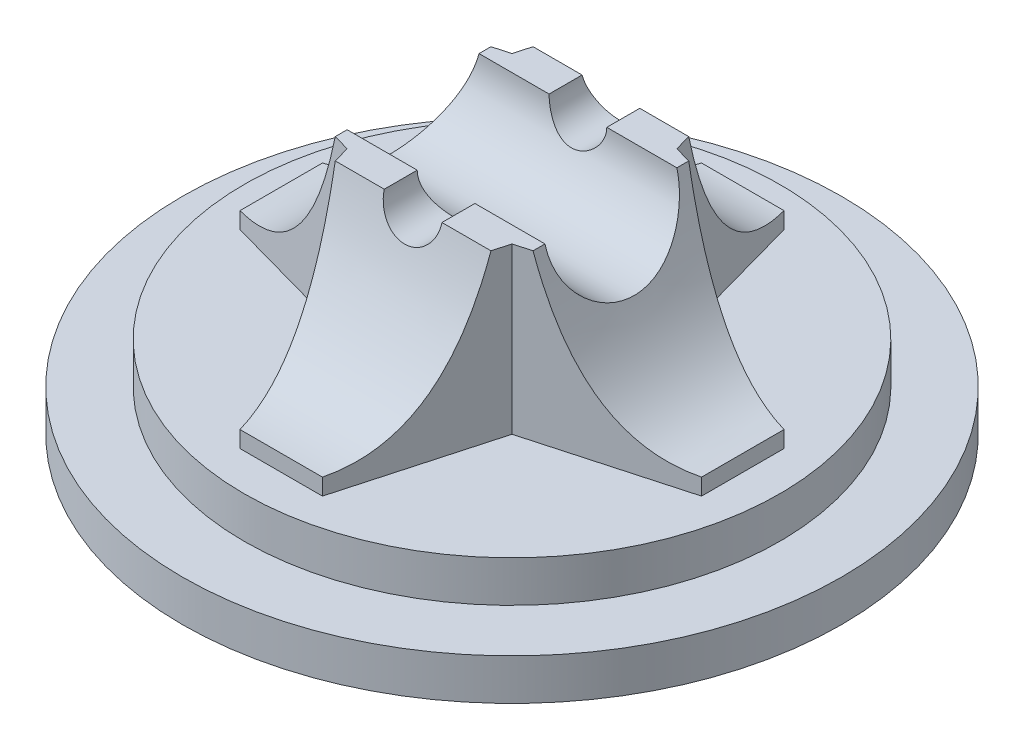
from build123d import *

# Parameters (mm, degrees)
SKETCH1_R           = 40
BOSS_EXTRUDE1_DEPTH = 5
SKETCH2_R           = 32.5
BOSS_EXTRUDE2_DEPTH = 5
BOSS_EXTRUDE3_DEPTH = 20
CUT_EXTRUDE15_DEPTH = 85.403791384
CUT_EXTRUDE16_DEPTH = 85.40379142
CUT_EXTRUDE22_DEPTH = 85.40379142
CUT_EXTRUDE23_DEPTH = 85.40379142


with BuildPart() as part:
    # Sketch1 → Boss-Extrude1 (new body)
    with BuildSketch(Plane(origin=(0, 0, 0), x_dir=(1, 0, 0), z_dir=(0, 1, 0))):
        Circle(SKETCH1_R)
    extrude(amount=BOSS_EXTRUDE1_DEPTH)

    # Sketch2 → Boss-Extrude2 (add)
    with BuildSketch(Plane(origin=(0, 5, 0), x_dir=(1, 0, 0), z_dir=(0, 1, 0))):
        Circle(SKETCH2_R)
    extrude(amount=BOSS_EXTRUDE2_DEPTH)

    # Sketch6 → Boss-Extrude3 (add)
    with BuildSketch(Plane(origin=(0, 10, 0), x_dir=(1, 0, 0), z_dir=(0, 1, 0))):
        Polygon((5, -28), (10, -10), (28, -5), (28, 5), (10, 10), (5, 28), (-5, 28), (-10, 10), (-28, 5), (-28, -5), (-10, -10), (-5, -28), align=None)
    extrude(amount=BOSS_EXTRUDE3_DEPTH)

    # Sketch12 → Cut-Extrude15 (cut, through all)
    with BuildSketch(Plane(origin=(0, 0, -28), x_dir=(-1, 0, 0), z_dir=(0, 0, -1))):
        with BuildLine():
            add(Edge.make_bspline(
                [(12, 30), (16.636316338, 12.206521784), (28, 12)],
                knots=[0, 0, 0, 0.849765105, 0.849765105, 0.849765105], degree=2))
            Line((28, 12), (28, 30))
            Line((28, 30), (12, 30))
        make_face()
        with BuildLine():
            Line((-28, 30), (-28, 12))
            add(Edge.make_bspline(
                [(-12, 30), (-16.636316338, 12.206521784), (-28, 12)],
                knots=[0, 0, 0, 0.849765105, 0.849765105, 0.849765105], degree=2))
            Line((-12, 30), (-28, 30))
        make_face()
    extrude(amount=-CUT_EXTRUDE15_DEPTH, mode=Mode.SUBTRACT)

    # Sketch13 → Cut-Extrude16 (cut, through all)
    with BuildSketch(Plane(origin=(28, 0, 0), x_dir=(0, 0, -1), z_dir=(1, 0, 0))):
        with BuildLine():
            add(Edge.make_bspline(
                [(12, 30), (16.636316338, 12.206521784), (28, 12)],
                knots=[0, 0, 0, 0.849765105, 0.849765105, 0.849765105], degree=2))
            Line((28, 12), (28, 30))
            Line((28, 30), (12, 30))
        make_face()
        with BuildLine():
            Line((-28, 30), (-28, 12))
            add(Edge.make_bspline(
                [(-12, 30), (-16.636316338, 12.206521784), (-28, 12)],
                knots=[0, 0, 0, 0.849765105, 0.849765105, 0.849765105], degree=2))
            Line((-12, 30), (-28, 30))
        make_face()
    extrude(amount=-CUT_EXTRUDE16_DEPTH, mode=Mode.SUBTRACT)

    # Sketch15 → Cut-Extrude22 (cut, through all)
    with BuildSketch(Plane.XY.offset(28)):
        with BuildLine():
            ThreePointArc((-3.5, 30), (0, 26.5), (3.5, 30))
            Line((3.5, 30), (-3.5, 30))
        make_face()
    extrude(amount=-CUT_EXTRUDE22_DEPTH, mode=Mode.SUBTRACT)

    # Sketch16 → Cut-Extrude23 (cut, through all)
    with BuildSketch(Plane(origin=(28, 0, 0), x_dir=(0, 0, -1), z_dir=(1, 0, 0))):
        with BuildLine():
            ThreePointArc((-8, 30), (0, 22), (8, 30))
            Line((8, 30), (-8, 30))
        make_face()
    extrude(amount=-CUT_EXTRUDE23_DEPTH, mode=Mode.SUBTRACT)


solid = part.part
